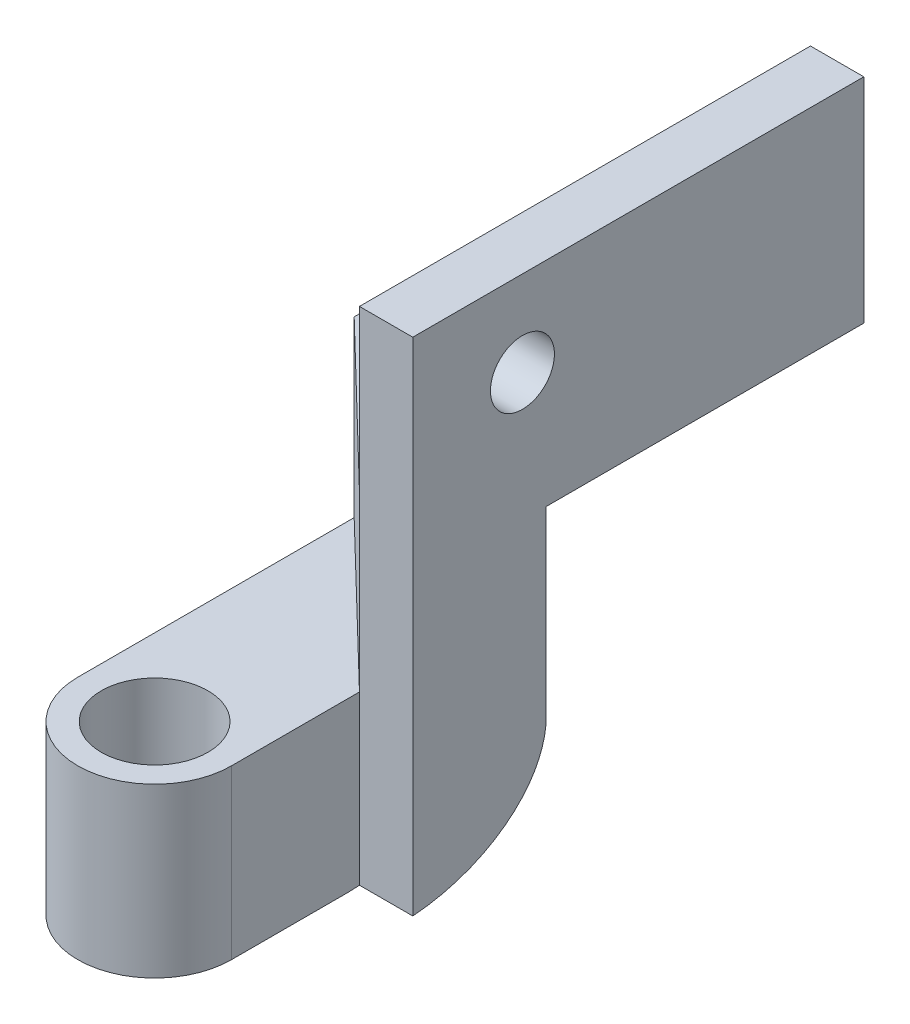
from build123d import *

# Parameters (mm, degrees)
CROQUIS1_R              = 1.5
SALIENTE_EXTRUIR1_DEPTH = 2.5
SALIENTE_EXTRUIR2_START = -8.15
CROQUIS1_4_R            = 2.5
SALIENTE_EXTRUIR2_DEPTH = 7.87
SALIENTE_EXTRUIR3_DEPTH = 16.02
REDONDEO1_R             = 5
CROQUIS3_W              = 21.14
CROQUIS3_H              = 7.5
CROQUIS3_R              = 1.5
SALIENTE_EXTRUIR4_DEPTH = 2.5


with BuildPart() as part:
    # Croquis1 → Saliente-Extruir1 (new body)
    # profile 1 of 2: a face of its own
    with BuildSketch(Plane(origin=(0, 0, 0), x_dir=(1, 0, 0), z_dir=(0, 1, 0))):
        Polygon((3.6, 27.14), (-3.6, 27.14), (-3.6, 19.208695338), (3.6, 12.25573616), align=None)
        with Locations(Location((-0.4, 21.14, 0), (0, 0, 270))):
            Circle(CROQUIS1_R, mode=Mode.SUBTRACT)
    # profile 2 of 2: a face of its own
    with BuildSketch(Plane(origin=(0, 0, 0), x_dir=(1, 0, 0), z_dir=(0, 1, 0))):
        Polygon((3.6, 12.25573616), (-3.6, 19.208695338), (-3.6, 12.952959179), (3.6, 6), align=None)
    extrude(amount=-SALIENTE_EXTRUIR1_DEPTH)



with BuildPart() as body_2:
    # Croquis1<4> → Saliente-Extruir2 (new body)
    with BuildSketch(Plane(origin=(0, 0, 0), x_dir=(1, 0, 0), z_dir=(0, 1, 0)).offset(SALIENTE_EXTRUIR2_START)):
        with BuildLine():
            Line((3.6, 6), (-3.6, 12.952959179))
            Line((-3.6, 12.952959179), (-3.6, 0))
            ThreePointArc((-3.6, 0), (0, -3.6), (3.6, 0))
            Line((3.6, 0), (3.6, 6))
        make_face()
        with Locations(Location((0, 0, 0), (0, 0, 270))):
            Circle(CROQUIS1_4_R, mode=Mode.SUBTRACT)
    extrude(amount=-SALIENTE_EXTRUIR2_DEPTH)


with BuildPart() as part_1:
    add(part.part)

    add(body_2.part)  # Saliente-Extruir3 merges body 2
    # Croquis1<5> → Saliente-Extruir3 (add)
    with BuildSketch(Plane(origin=(0, 0, 0), x_dir=(1, 0, 0), z_dir=(0, 1, 0))):
        Polygon((3.6, 12.25573616), (-3.6, 19.208695338), (-3.6, 12.952959179), (3.6, 6), align=None)
    extrude(amount=-SALIENTE_EXTRUIR3_DEPTH)

    # Redondeo1
    redondeo1_edges = [part_1.edges().sort_by_distance(p)[0] for p in [
        (0, -16.02, -15.732215749),
    ]]
    fillet(redondeo1_edges, radius=REDONDEO1_R)

    # Croquis3 → Saliente-Extruir4 (add)
    # profile 1 of 2: a face of its own
    with BuildSketch(Plane(origin=(3.6, 0, 0), x_dir=(0, 0, -1), z_dir=(1, 0, 0))):
        with BuildLine():
            Line((6, 0), (6, -8.15))
            Line((6, -8.15), (6, -15.994937186))
            add(Edge.make_bspline(
                [(6, -15.994937186), (12.25573616, -15.542670169), (12.25573616, -11.02)],
                knots=[4.821475205, 4.821475205, 4.821475205, 6.283185307, 6.283185307, 6.283185307], degree=2, weights=[0.962144349, 0.727447175, 1]))
            Line((12.25573616, -11.02), (12.25573616, -2.5))
            Line((12.25573616, -2.5), (27.14, -2.5))
            Line((27.14, -2.5), (27.14, 0))
            Line((27.14, 0), (6, 0))
        make_face()
    # profile 2 of 2: a face of its own
    with BuildSketch(Plane(origin=(3.6, 0, 0), x_dir=(0, 0, -1), z_dir=(1, 0, 0))):
        with Locations((16.57, 3.75)):
            Rectangle(CROQUIS3_W, CROQUIS3_H)
        with Locations((11.14, 3.5)):
            Circle(CROQUIS3_R, mode=Mode.SUBTRACT)
    extrude(amount=SALIENTE_EXTRUIR4_DEPTH)


solid = part_1.part
